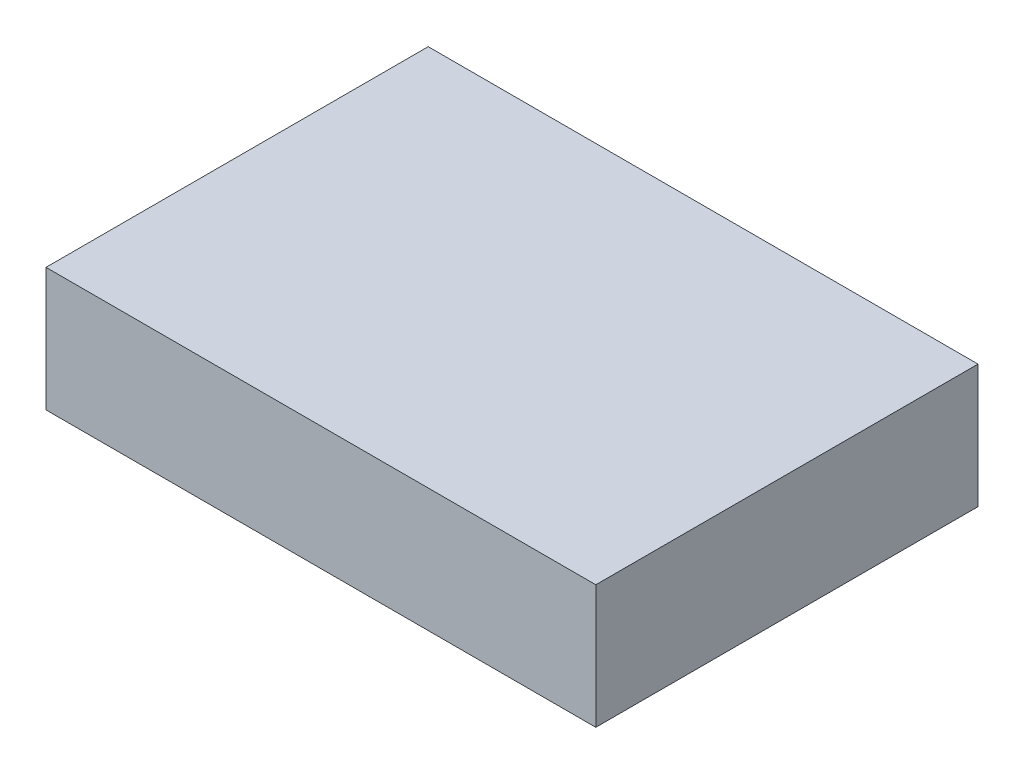
from build123d import *

# Parameters (mm, degrees)
SKETCH1_W           = 935
SKETCH1_H           = 650
BOSS_EXTRUDE1_DEPTH = 210


with BuildPart() as part:
    # Sketch1 → Boss-Extrude1 (new body)
    with BuildSketch(Plane(origin=(0, 0, 0), x_dir=(1, 0, 0), z_dir=(0, 1, 0))):
        with Locations((0, 325)):
            Rectangle(SKETCH1_W, SKETCH1_H)
    extrude(amount=-BOSS_EXTRUDE1_DEPTH)


solid = part.part
